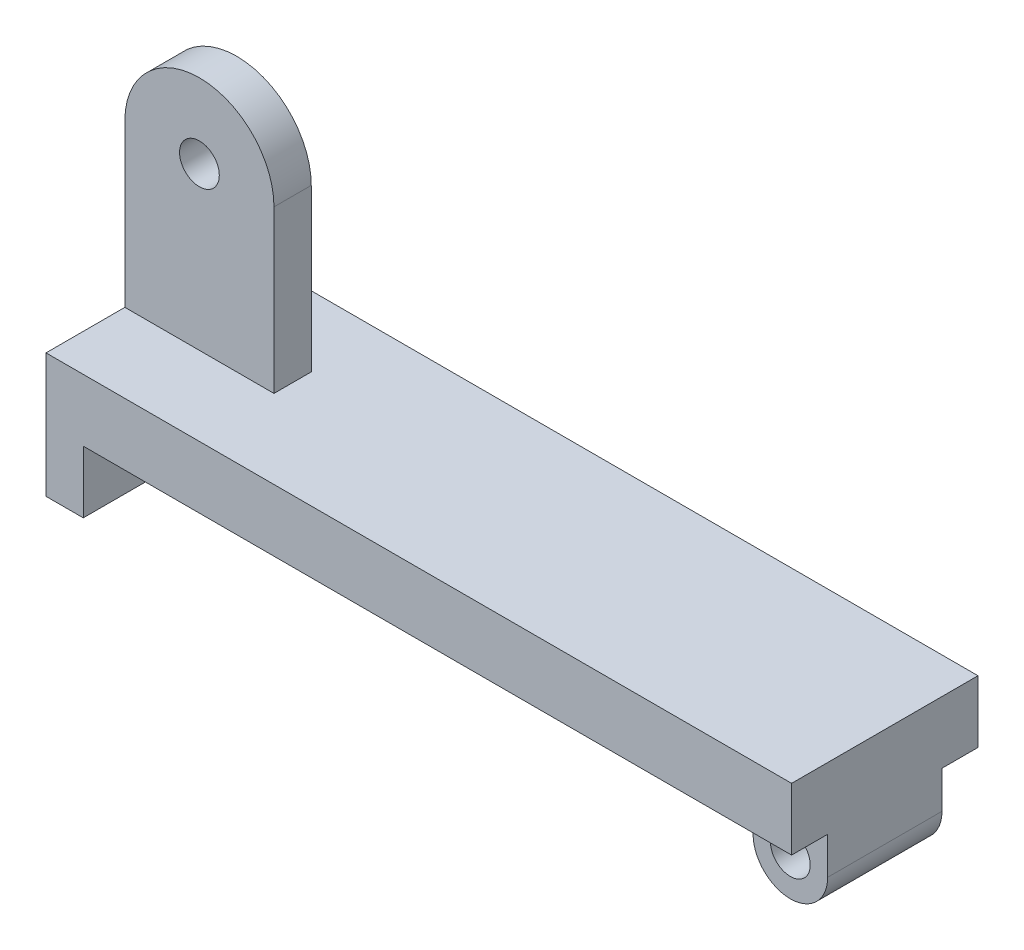
from build123d import *

# Parameters (mm, degrees)
SKETCH_1_W          = 60
SKETCH_1_H          = 15
EXTRUDE_1_DEPTH     = 5
SKETCH_2_W          = 3
SKETCH_2_H          = 15
EXTRUDE_2_DEPTH     = 5
SKETCH_3_W          = 6
SKETCH_3_H          = 10
EXTRUDE_3_DEPTH     = 6
CUT_EXTRUDE_1_DEPTH = 20
SKETCH_5_R          = 1.6
CUT_EXTRUDE_2_DEPTH = 20
SKETCH_6_W          = 12
SKETCH_6_H          = 3.8
EXTRUDE_5_DEPTH     = 19
SKETCH_10_R         = 1.6
CUT_EXTRUDE_4_DEPTH = 19
CUT_EXTRUDE_5_DEPTH = 19
SKETCH_12_W         = 12
SKETCH_12_H         = 19
CUT_EXTRUDE_6_DEPTH = 0.4
SKETCH_13_W         = 12
SKETCH_13_H         = 19
CUT_EXTRUDE_7_DEPTH = 0.4
SKETCH_14_W         = 6
SKETCH_14_H         = 6
CUT_EXTRUDE_8_DEPTH = 0.4
SKETCH_15_W         = 6
SKETCH_15_H         = 6
CUT_EXTRUDE_9_DEPTH = 0.4


with BuildPart() as part:
    # 草图1 → 凸台-拉伸1 (new body)
    with BuildSketch(Plane(origin=(0, 0, 0), x_dir=(1, 0, 0), z_dir=(0, 1, 0))):
        with Locations((-1.623095887, 6.001870645)):
            Rectangle(SKETCH_1_W, SKETCH_1_H)
    extrude(amount=EXTRUDE_1_DEPTH)

    # 草图2 → 凸台-拉伸2 (add)
    with BuildSketch(Plane.XZ):
        with Locations((-30.123095887, -6.001870645)):
            Rectangle(SKETCH_2_W, SKETCH_2_H)
    extrude(amount=EXTRUDE_2_DEPTH)

    # 草图3 → 凸台-拉伸3 (add)
    with BuildSketch(Plane.XZ):
        with Locations((25.376904113, -6.001870645)):
            Rectangle(SKETCH_3_W, SKETCH_3_H)
    extrude(amount=EXTRUDE_3_DEPTH)

    # 草图4 → 切除-拉伸1 (cut)
    with BuildSketch(Plane.XY.offset(-1.001870645)):
        with BuildLine():
            ThreePointArc((28.376904113, -3), (27.498224456, -5.121320344), (25.376904113, -6))
            Line((25.376904113, -6), (28.376904113, -6))
            Line((28.376904113, -6), (28.376904113, -3))
        make_face()
        with BuildLine():
            ThreePointArc((25.376904113, -6), (23.255583769, -5.121320344), (22.376904113, -3))
            Line((22.376904113, -3), (22.376904113, -6))
            Line((22.376904113, -6), (25.376904113, -6))
        make_face()
    extrude(amount=-CUT_EXTRUDE_1_DEPTH, mode=Mode.SUBTRACT)

    # 草图5 → 切除-拉伸2 (cut)
    with BuildSketch(Plane.XY.offset(-1.001870645)):
        with Locations((25.376904113, -2.840959341)):
            Circle(SKETCH_5_R)
    extrude(amount=-CUT_EXTRUDE_2_DEPTH, mode=Mode.SUBTRACT)

    # 草图6 → 凸台-拉伸5 (add)
    with BuildSketch(Plane(origin=(0, 5, 0), x_dir=(1, 0, 0), z_dir=(0, 1, 0))):
        with Locations((-25.623095887, 6.347440939)):
            Rectangle(SKETCH_6_W, SKETCH_6_H)
    extrude(amount=EXTRUDE_5_DEPTH)

    # 草图10 → 切除-拉伸4 (cut)
    with BuildSketch(Plane.XY.offset(-4.447440939)):
        with Locations((-25.623095887, 18)):
            Circle(SKETCH_10_R)
    extrude(amount=-CUT_EXTRUDE_4_DEPTH, mode=Mode.SUBTRACT)

    # 草图11 → 切除-拉伸5 (cut)
    with BuildSketch(Plane.XY.offset(-4.447440939)):
        with BuildLine():
            Line((-31.623095887, 24), (-31.623095887, 18))
            ThreePointArc((-31.623095887, 18), (-29.865736574, 22.242640687), (-25.623095887, 24))
            Line((-25.623095887, 24), (-31.623095887, 24))
        make_face()
        with BuildLine():
            Line((-19.623095887, 24), (-25.623095887, 24))
            ThreePointArc((-25.623095887, 24), (-21.3804552, 22.242640687), (-19.623095887, 18))
            Line((-19.623095887, 18), (-19.623095887, 24))
        make_face()
    extrude(amount=-CUT_EXTRUDE_5_DEPTH, mode=Mode.SUBTRACT)

    # 草图12 → 切除-拉伸6 (cut)
    with BuildSketch(Plane.XY.offset(-4.447440939)):
        with Locations((-25.623095887, 14.5)):
            Rectangle(SKETCH_12_W, SKETCH_12_H)
    extrude(amount=-CUT_EXTRUDE_6_DEPTH, mode=Mode.SUBTRACT)

    # 草图13 → 切除-拉伸7 (cut)
    with BuildSketch(Plane(origin=(0, 0, -8.247440939), x_dir=(-1, 0, 0), z_dir=(0, 0, -1))):
        with Locations((25.623095887, 14.5)):
            Rectangle(SKETCH_13_W, SKETCH_13_H)
    extrude(amount=-CUT_EXTRUDE_7_DEPTH, mode=Mode.SUBTRACT)

    # 草图14 → 切除-拉伸8 (cut)
    with BuildSketch(Plane(origin=(0, 0, -11.001870645), x_dir=(-1, 0, 0), z_dir=(0, 0, -1))):
        with Locations((-25.376904113, -3)):
            Rectangle(SKETCH_14_W, SKETCH_14_H)
    extrude(amount=-CUT_EXTRUDE_8_DEPTH, mode=Mode.SUBTRACT)

    # 草图15 → 切除-拉伸9 (cut)
    with BuildSketch(Plane.XY.offset(-1.001870645)):
        with Locations((25.376904113, -3)):
            Rectangle(SKETCH_15_W, SKETCH_15_H)
    extrude(amount=-CUT_EXTRUDE_9_DEPTH, mode=Mode.SUBTRACT)


solid = part.part
